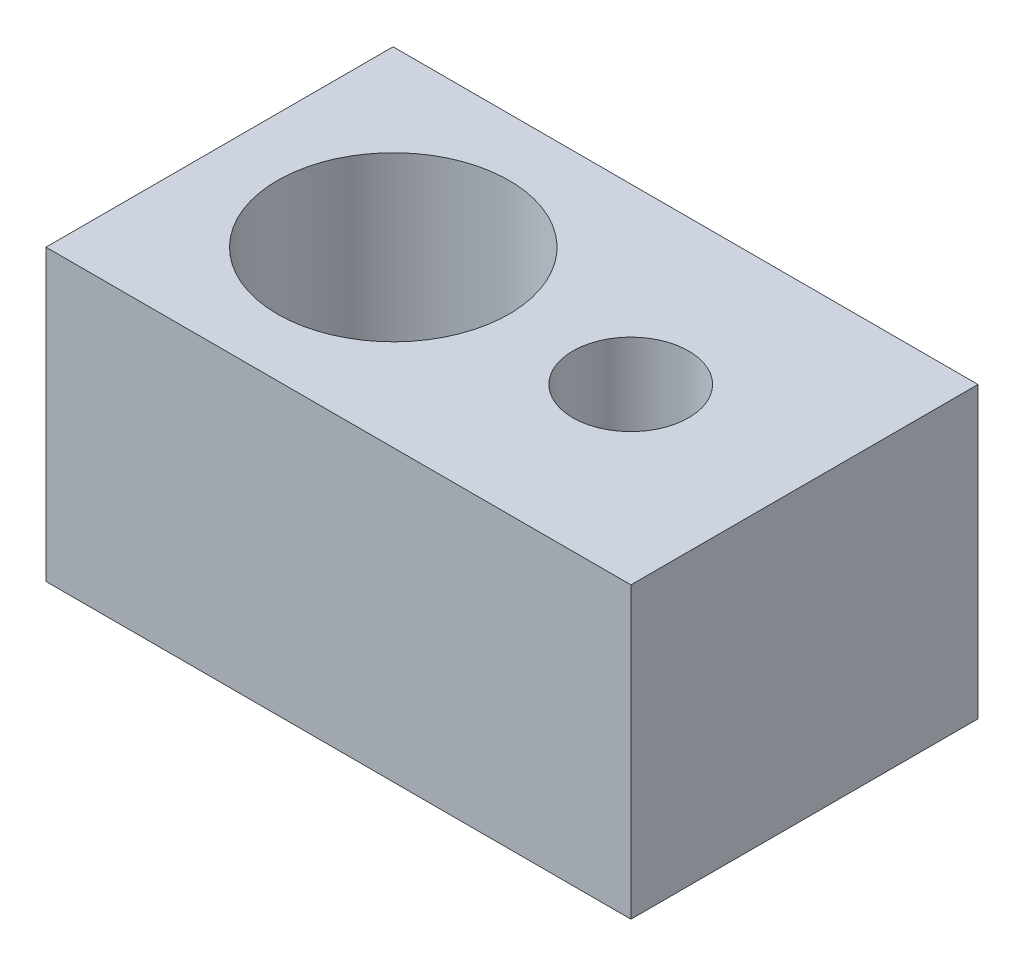
from build123d import *

# Parameters (mm, degrees)
SKETCH1_W           = 101
SKETCH1_H           = 59.932047928
SKETCH1_R           = 11
SKETCH1_R_2         = 10
BOSS_EXTRUDE1_DEPTH = 50
SKETCH3_R           = 17
CUT_EXTRUDE1_DEPTH  = 10
SKETCH4_R           = 20
CUT_EXTRUDE2_DEPTH  = 39


with BuildPart() as part:
    # Sketch1 → Boss-Extrude1 (new body)
    with BuildSketch(Plane(origin=(0, 0, 0), x_dir=(1, 0, 0), z_dir=(0, 1, 0))):
        Rectangle(SKETCH1_W, SKETCH1_H)
        with Locations(Location((-20.5, 0, 0), (0, 0, 270))):
            Circle(SKETCH1_R, mode=Mode.SUBTRACT)
        with Locations(Location((20.5, 0, 0), (0, 0, 270))):
            Circle(SKETCH1_R_2, mode=Mode.SUBTRACT)
    extrude(amount=BOSS_EXTRUDE1_DEPTH)

    # Sketch3 → Cut-Extrude1 (cut)
    with BuildSketch(Plane.XZ):
        with Locations(Location((-20.5, 0, 0), (0, 0, 270))):
            Circle(SKETCH3_R)
    extrude(amount=-CUT_EXTRUDE1_DEPTH, mode=Mode.SUBTRACT)

    # Sketch4 → Cut-Extrude2 (cut)
    with BuildSketch(Plane(origin=(0, 50, 0), x_dir=(1, 0, 0), z_dir=(0, 1, 0))):
        with Locations(Location((-20.5, 0, 0), (0, 0, 270))):
            Circle(SKETCH4_R)
    extrude(amount=-CUT_EXTRUDE2_DEPTH, mode=Mode.SUBTRACT)


solid = part.part
